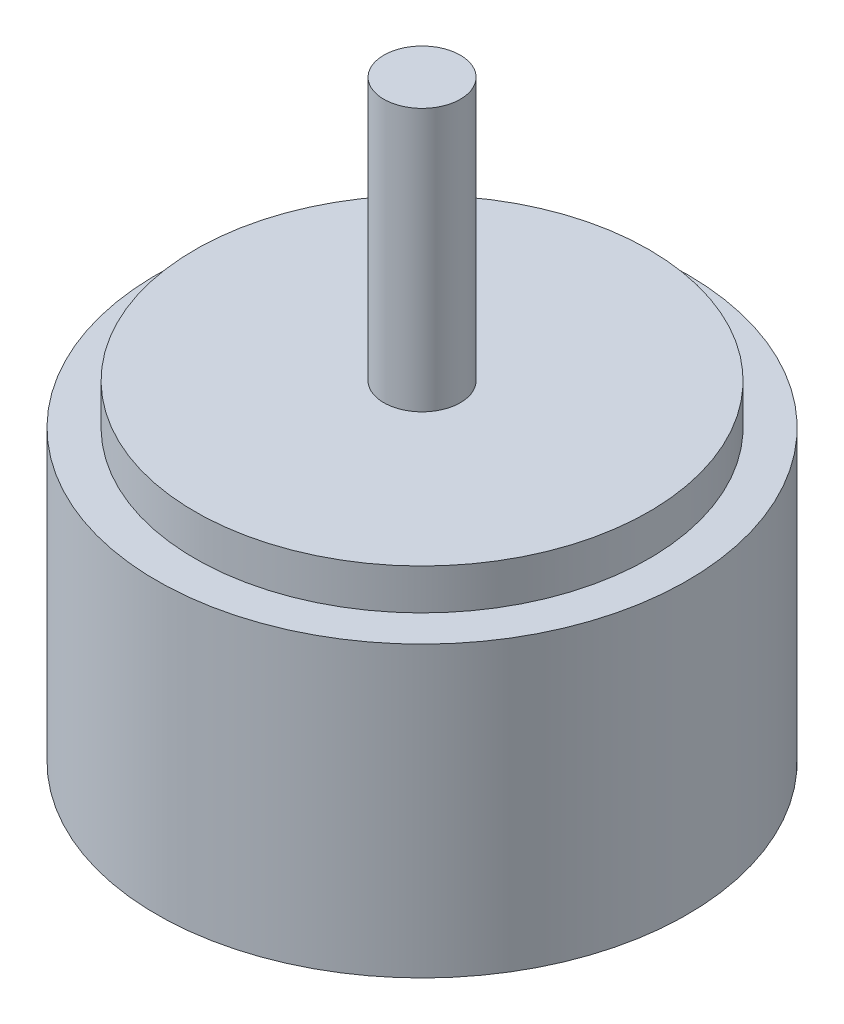
from build123d import *


with BuildPart() as part:
    # Sketch1 → Revolve1 (revolve)
    with BuildSketch(Plane.XY, mode=Mode.PRIVATE) as revolve1_sk:
        Polygon((0, 0), (11.1, 0), (11.1, 12.1), (9.5, 12.1), (9.5, 13.8), (1.6, 13.8), (1.6, 24.8), (0, 24.8), align=None)
    revolve(revolve1_sk.sketch.rotate(Axis((0, 0, 0), (0, 1, 0)), 90), axis=Axis((0, 0, 0), (0, 1, 0)))


solid = part.part
